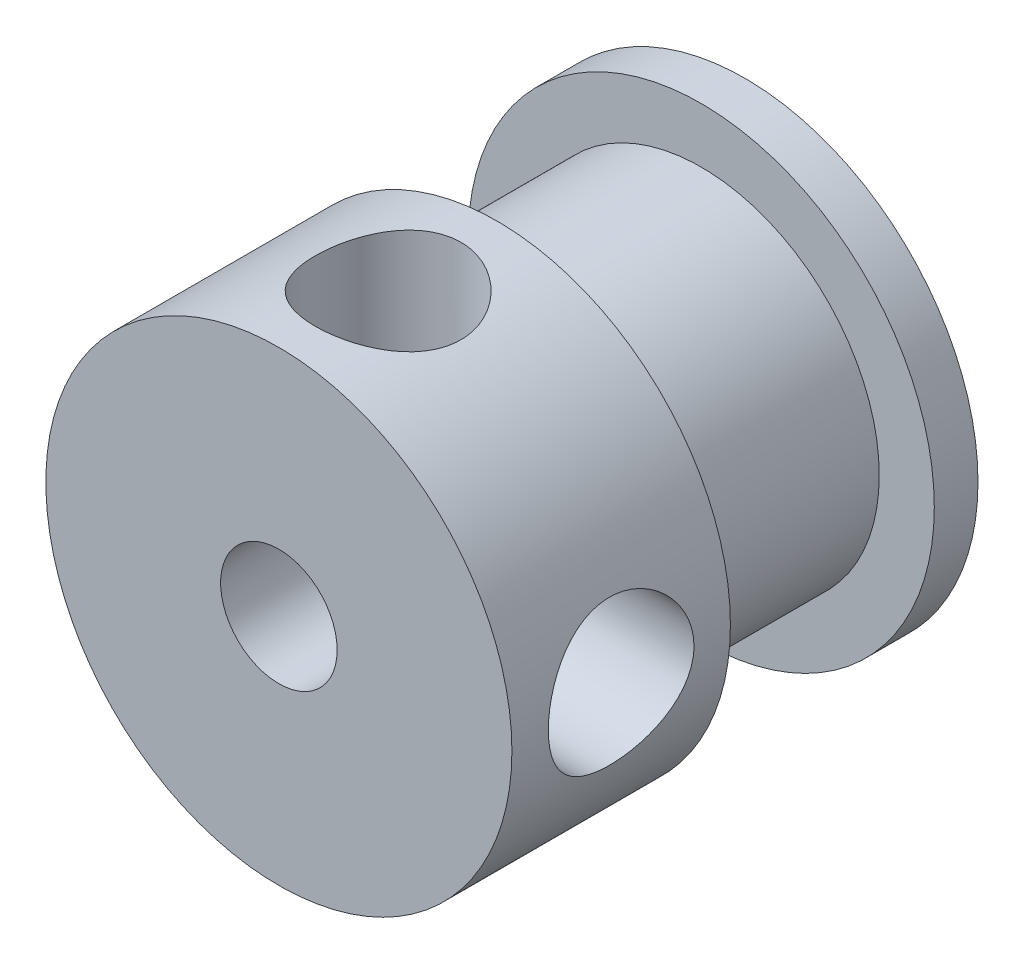
from build123d import *

# Parameters (mm, degrees)
SKETCH1_R               = 8
BOSS_EXTRUDE1_DEPTH     = 1.5
SKETCH2_R               = 6.11
BOSS_EXTRUDE2_DEPTH     = 7
SKETCH4_R               = 8
BOSS_EXTRUDE4_DEPTH     = 7.5
SKETCH6_R               = 2
CUT_EXTRUDE1_DEPTH      = 16
CUT_EXTRUDE2_REACH      = 21.596
CUT_EXTRUDE2_END_RADIUS = 8
SKETCH7_R               = 2.5
CUT_EXTRUDE3_REACH      = 21.596
CUT_EXTRUDE3_END_RADIUS = 8
SKETCH8_R               = 2.5


with BuildPart() as part:
    # Sketch1 → Boss-Extrude1 (new body)
    with BuildSketch(Plane.XY):
        Circle(SKETCH1_R)
    extrude(amount=BOSS_EXTRUDE1_DEPTH)

    # Sketch2 → Boss-Extrude2 (add)
    with BuildSketch(Plane.XY.offset(1.5)):
        Circle(SKETCH2_R)
    extrude(amount=BOSS_EXTRUDE2_DEPTH)

    # Sketch4 → Boss-Extrude4 (add)
    with BuildSketch(Plane.XY.offset(8.5)):
        Circle(SKETCH4_R)
    extrude(amount=BOSS_EXTRUDE4_DEPTH)

    # Sketch6 → Cut-Extrude1 (cut)
    with BuildSketch(Plane.XY.offset(16)):
        Circle(SKETCH6_R)
    extrude(amount=-CUT_EXTRUDE1_DEPTH, mode=Mode.SUBTRACT)

    # Cut-Extrude2: up to this cylinder (the profile starts inside it)
    cut_extrude2_end = Plane(origin=(0, 0, 12.25), z_dir=(0, 0, -1)) * Cylinder(CUT_EXTRUDE2_END_RADIUS, 60.192, mode=Mode.PRIVATE)
    # Sketch7 → Cut-Extrude2 (cut, up to the surface)
    with BuildSketch(Plane.ZY, mode=Mode.PRIVATE) as cut_extrude2_sk1:
        with Locations((12.25, 0)):
            Circle(SKETCH7_R)
    cut_extrude2_tool1 = extrude(cut_extrude2_sk1.sketch, amount=-CUT_EXTRUDE2_REACH, mode=Mode.PRIVATE) & cut_extrude2_end
    add(cut_extrude2_tool1.solids().sort_by_distance((0, 0, 12.25))[0], mode=Mode.SUBTRACT)

    # Cut-Extrude3: up to this cylinder (the profile starts inside it)
    cut_extrude3_end = Plane(origin=(0, 0, 12.25), z_dir=(0, 0, -1)) * Cylinder(CUT_EXTRUDE3_END_RADIUS, 60.192, mode=Mode.PRIVATE)
    # Sketch8 → Cut-Extrude3 (cut, up to the surface)
    with BuildSketch(Plane(origin=(0, 0, 0), x_dir=(0, 0, 1), z_dir=(0, -1, 0)), mode=Mode.PRIVATE) as cut_extrude3_sk1:
        with Locations(Location((12.25, 0, 0), (0, 0, 180))):
            Circle(SKETCH8_R)
    cut_extrude3_tool1 = extrude(cut_extrude3_sk1.sketch, amount=-CUT_EXTRUDE3_REACH, mode=Mode.PRIVATE) & cut_extrude3_end
    add(cut_extrude3_tool1.solids().sort_by_distance((0, 0, 12.25))[0], mode=Mode.SUBTRACT)


solid = part.part
